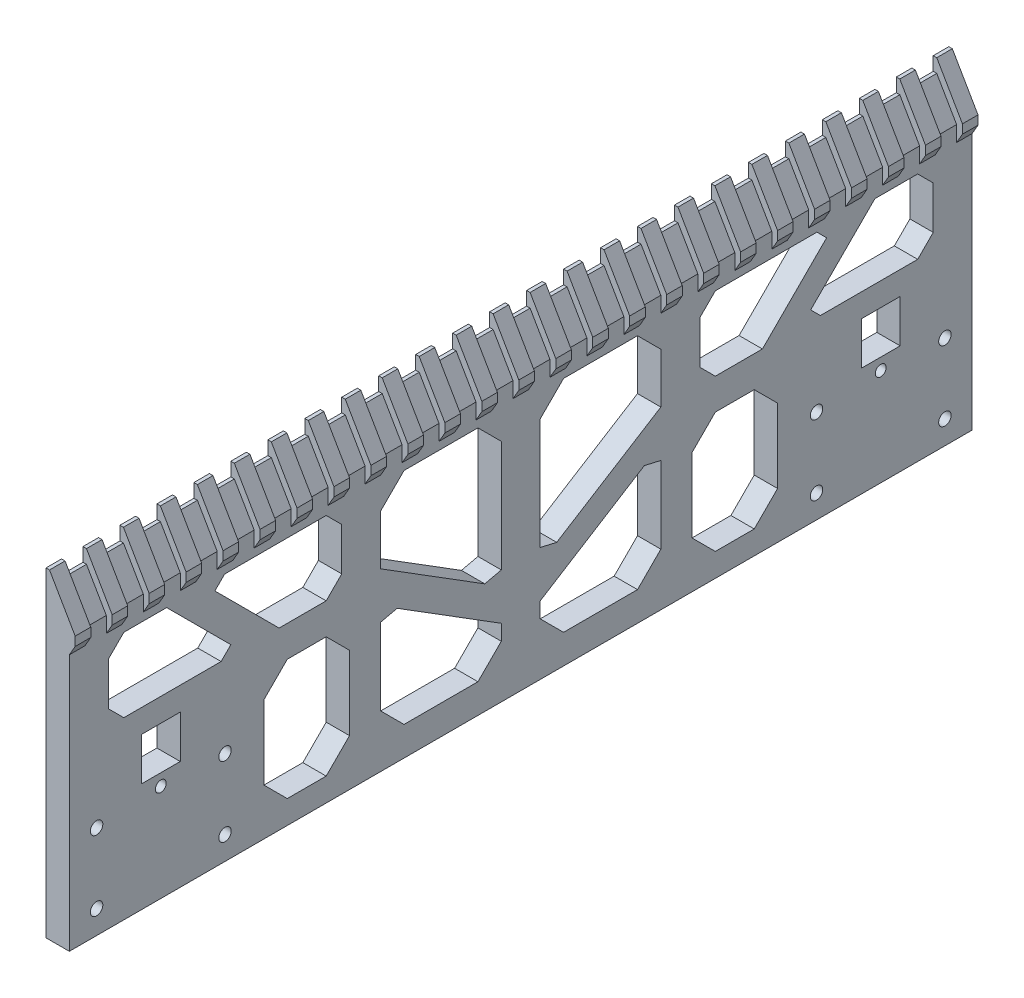
from build123d import *
from OCP.BRepFilletAPI import BRepFilletAPI_MakeChamfer

# Parameters (mm, degrees)
SKETCH_1_W                    = 232
SKETCH_1_H                    = 70
EXTRUDE_1_DEPTH               = 6
CUT_EXTRUDE_2_DEPTH           = 136.617108065
CHAMFER_1_SIZE                = 5
CHAMFER_1_SIZE2               = 3.535533906
CHAMFER_1_SIZE2_2             = 3.628532971
EXTRUDE_2_DEPTH               = 232
EXTRUDE_3_DEPTH               = 4
PATTERN_LINEAR_1_COUNT        = 25
PATTERN_LINEAR_1_PITCH        = 9.5
HOLE_WIZARD_1_D               = 3.2
HOLE_WIZARD_1_CSINK_D         = 6.6
HOLE_WIZARD_1_CSINK_ANGLE     = 90
SKETCH_16_R                   = 1.4
CUT_EXTRUDE_3_DEPTH           = 10
CHAMFER_1_OF_MIRROR_2_SIZE    = 5
CHAMFER_1_OF_MIRROR_2_SIZE2   = 3.535533906
CHAMFER_1_OF_MIRROR_2_SIZE2_2 = 3.628532971
SKETCH_17_W                   = 10
SKETCH_17_H                   = 11
CUT_EXTRUDE_4_DEPTH           = 136.691746249


with BuildPart() as part:
    # 草图1 → 凸台-拉伸1 (new body)
    with BuildSketch(Plane(origin=(0, 0, 0), x_dir=(0, 0, -1), z_dir=(1, 0, 0))):
        with Locations((0, -35)):
            Rectangle(SKETCH_1_W, SKETCH_1_H)
    extrude(amount=EXTRUDE_1_DEPTH)

    # 草图3 → 切除-拉伸2 (cut, through all)
    with BuildSketch(Plane(origin=(6, 0, 0), x_dir=(0, 0, -1), z_dir=(1, 0, 0))):
        Polygon((-102, -6), (-91, -6), (-72, -25), (-102, -25), (-106, -21), (-106, -10), align=None)
        Polygon((-46, -10), (-46, -21), (-50, -25), (-62.100505063, -25), (-81.100505063, -6), (-50, -6), align=None)
        Polygon((-36, -12), (-30, -6), (-11, -6), (-5, -12), (-5, -44.245751176), (-36, -24.874801267), align=None)
        Polygon((-66, -58), (-60, -64), (-50, -64), (-44, -58), (-44, -39), (-50, -33), (-60, -33), (-66, -39), align=None)
        Polygon((-30, -62.5), (-11, -62.5), (-5, -56.5), (-5, -52.5), (-36, -33.129050091), (-36, -56.5), align=None)
    cut_extrude_2 = extrude(amount=-CUT_EXTRUDE_2_DEPTH, mode=Mode.SUBTRACT)

    # 倒角1: one chamfer whose edges measure the first distance from different faces: ONE call of the kernel's chamfer builder (chamfer() names one face for all edges)
    chamfer_1_edges_1 = [part.edges().sort_by_distance(p)[0] for p in [
        (3, -6, 81.100505063),
    ]]
    chamfer_1_side_1 = [part.faces().sort_by_distance(p)[0] for p in [
        (3, -6, 65.550252532),
    ]]
    chamfer_1_edges_2 = [part.edges().sort_by_distance(p)[0] for p in [
        (3, -44.245751176, 5),
    ]]
    chamfer_1_side_2 = [part.faces().sort_by_distance(p)[0] for p in [
        (3, -34.560276222, 20.5),
    ]]
    chamfer_1_edges_3 = [part.edges().sort_by_distance(p)[0] for p in [
        (3, -33.129050091, 36),
    ]]
    chamfer_1_side_3 = [part.faces().sort_by_distance(p)[0] for p in [
        (3, -42.814525045, 20.5),
    ]]
    chamfer_1_edges_4 = [part.edges().sort_by_distance(p)[0] for p in [
        (3, -25, 72),
    ]]
    chamfer_1_side_4 = [part.faces().sort_by_distance(p)[0] for p in [
        (3, -25, 87),
    ]]
    chamfer_1 = BRepFilletAPI_MakeChamfer(part.part.solid().wrapped)
    for e in chamfer_1_edges_1:
        chamfer_1.Add(CHAMFER_1_SIZE, CHAMFER_1_SIZE2, e.wrapped, chamfer_1_side_1[0].wrapped)  # the first distance lies on this face
    for e in chamfer_1_edges_2:
        chamfer_1.Add(CHAMFER_1_SIZE, CHAMFER_1_SIZE2_2, e.wrapped, chamfer_1_side_2[0].wrapped)  # the first distance lies on this face
    for e in chamfer_1_edges_3:
        chamfer_1.Add(CHAMFER_1_SIZE, CHAMFER_1_SIZE2_2, e.wrapped, chamfer_1_side_3[0].wrapped)  # the first distance lies on this face
    for e in chamfer_1_edges_4:
        chamfer_1.Add(CHAMFER_1_SIZE, CHAMFER_1_SIZE2, e.wrapped, chamfer_1_side_4[0].wrapped)  # the first distance lies on this face
    add(Compound.cast(chamfer_1.Shape()), mode=Mode.REPLACE)

    # 草图6 → 凸台-拉伸2 (add)
    with BuildSketch(Plane.XY.offset(116)):
        Polygon((6, 0), (0, 0), (0, 8.833459119), (0.9, 8.833459119), align=None)
    extrude(amount=-EXTRUDE_2_DEPTH)

    # 草图8 → 凸台-拉伸3 (add)
    with BuildSketch(Plane.XY.offset(116)):
        Polygon((0, 10.392304845), (0, 12.333459119), (0.9, 12.333459119), (7.5, 0.901923789), (7.5, -1.401923789), (6, -4), (6, 0), (0.9, 8.833459119), (0, 8.833459119), align=None)
    extrude_3 = extrude(amount=-EXTRUDE_3_DEPTH)

    # 阵列(线性)1: 凸台-拉伸3 ×25
    with Locations(*[(0, 0, -i * PATTERN_LINEAR_1_PITCH) for i in range(1, PATTERN_LINEAR_1_COUNT)]):
        add(extrude_3)

    # 打孔尺寸(%根据十字)槽沉头木螺钉的类型1 (through all)
    with Locations(Plane.ZY):
        with Locations((76, -46), (109, -46), (109, -64), (76, -64)):
            hole_wizard_1 = CounterSinkHole(HOLE_WIZARD_1_D / 2, HOLE_WIZARD_1_CSINK_D / 2, counter_sink_angle=HOLE_WIZARD_1_CSINK_ANGLE)

    # 草图16 → 切除-拉伸3 (cut)
    with BuildSketch(Plane.ZY):
        with Locations((92.5, -45)):
            Circle(SKETCH_16_R)
    cut_extrude_3 = extrude(amount=-CUT_EXTRUDE_3_DEPTH, mode=Mode.SUBTRACT)

    # 镜向1: 打孔尺寸(%根据十字)槽沉头木螺钉的类型1 across plane
    add(hole_wizard_1.mirror(Plane(origin=(0, 0, 0), x_dir=(1, 0, 0), z_dir=(0, 0, -1))), mode=Mode.SUBTRACT)

    # 镜向2: 切除-拉伸2, 切除-拉伸3 across plane
    add(cut_extrude_2.mirror(Plane(origin=(0, 0, 0), x_dir=(1, 0, 0), z_dir=(0, 0, -1))), mode=Mode.SUBTRACT)
    add(cut_extrude_3.mirror(Plane(origin=(0, 0, 0), x_dir=(1, 0, 0), z_dir=(0, 0, -1))), mode=Mode.SUBTRACT)

    # 倒角1 of 镜向2: one chamfer whose edges measure the first distance from different faces: ONE call of the kernel's chamfer builder (chamfer() names one face for all edges)
    chamfer_1_of_mirror_2_edges_1 = [part.edges().sort_by_distance(p)[0] for p in [
        (3, -6, -81.100505063),
    ]]
    chamfer_1_of_mirror_2_side_1 = [part.faces().sort_by_distance(p)[0] for p in [
        (3, -6, -65.550252532),
    ]]
    chamfer_1_of_mirror_2_edges_2 = [part.edges().sort_by_distance(p)[0] for p in [
        (3, -44.245751176, -5),
    ]]
    chamfer_1_of_mirror_2_side_2 = [part.faces().sort_by_distance(p)[0] for p in [
        (3, -34.560276222, -20.5),
    ]]
    chamfer_1_of_mirror_2_edges_3 = [part.edges().sort_by_distance(p)[0] for p in [
        (3, -33.129050091, -36),
    ]]
    chamfer_1_of_mirror_2_side_3 = [part.faces().sort_by_distance(p)[0] for p in [
        (3, -42.814525045, -20.5),
    ]]
    chamfer_1_of_mirror_2_edges_4 = [part.edges().sort_by_distance(p)[0] for p in [
        (3, -25, -72),
    ]]
    chamfer_1_of_mirror_2_side_4 = [part.faces().sort_by_distance(p)[0] for p in [
        (3, -25, -87),
    ]]
    chamfer_1_of_mirror_2 = BRepFilletAPI_MakeChamfer(part.part.solid().wrapped)
    for e in chamfer_1_of_mirror_2_edges_1:
        chamfer_1_of_mirror_2.Add(CHAMFER_1_OF_MIRROR_2_SIZE, CHAMFER_1_OF_MIRROR_2_SIZE2, e.wrapped, chamfer_1_of_mirror_2_side_1[0].wrapped)  # the first distance lies on this face
    for e in chamfer_1_of_mirror_2_edges_2:
        chamfer_1_of_mirror_2.Add(CHAMFER_1_OF_MIRROR_2_SIZE, CHAMFER_1_OF_MIRROR_2_SIZE2_2, e.wrapped, chamfer_1_of_mirror_2_side_2[0].wrapped)  # the first distance lies on this face
    for e in chamfer_1_of_mirror_2_edges_3:
        chamfer_1_of_mirror_2.Add(CHAMFER_1_OF_MIRROR_2_SIZE, CHAMFER_1_OF_MIRROR_2_SIZE2_2, e.wrapped, chamfer_1_of_mirror_2_side_3[0].wrapped)  # the first distance lies on this face
    for e in chamfer_1_of_mirror_2_edges_4:
        chamfer_1_of_mirror_2.Add(CHAMFER_1_OF_MIRROR_2_SIZE, CHAMFER_1_OF_MIRROR_2_SIZE2, e.wrapped, chamfer_1_of_mirror_2_side_4[0].wrapped)  # the first distance lies on this face
    add(Compound.cast(chamfer_1_of_mirror_2.Shape()), mode=Mode.REPLACE)

    # 草图17 → 切除-拉伸4 (cut, through all)
    with BuildSketch(Plane.ZY):
        with Locations((92.5, -36.5)):
            Rectangle(SKETCH_17_W, SKETCH_17_H)
        with Locations((-92.5, -36.5)):
            Rectangle(SKETCH_17_W, SKETCH_17_H)
    extrude(amount=-CUT_EXTRUDE_4_DEPTH, mode=Mode.SUBTRACT)


solid = part.part
